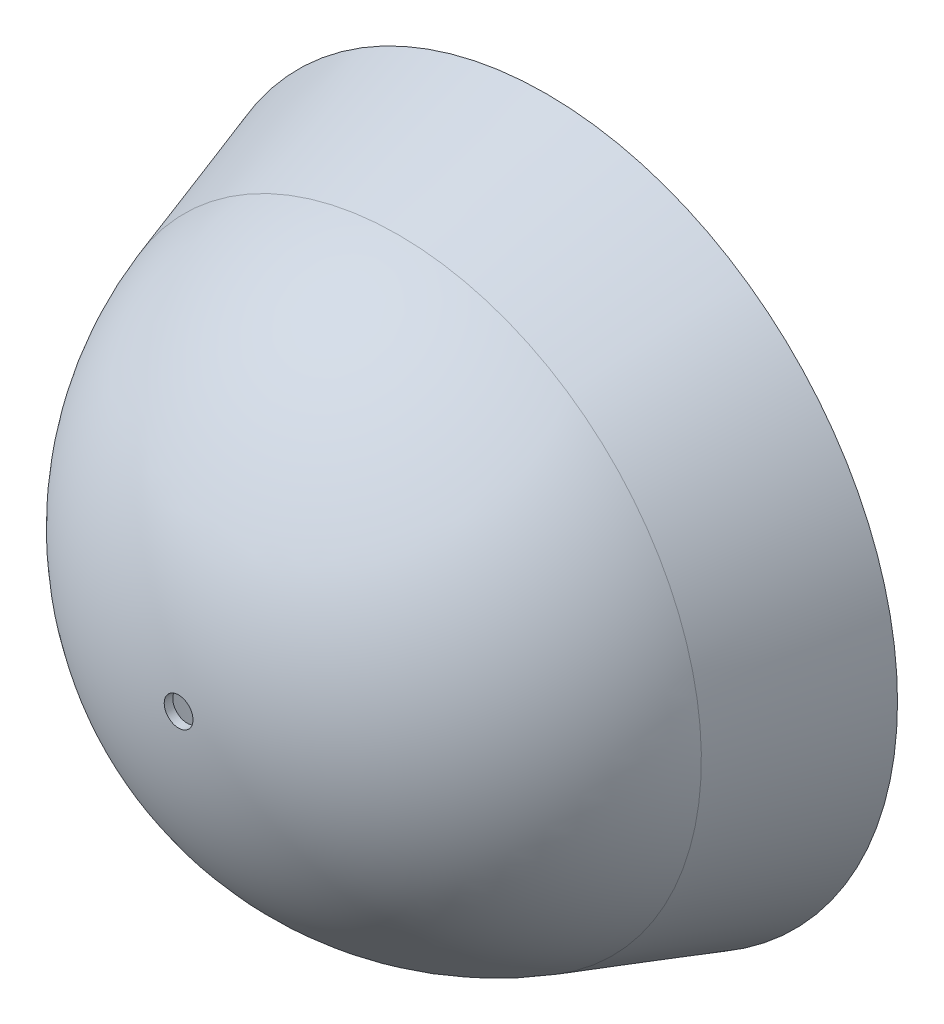
from build123d import *

# Parameters (mm, degrees)
SKETCH3_R                  = 3.683
CE_00_HOLE_AT_CENTER_DEPTH = 12.7


with BuildPart() as part:
    # Sketch1 → Revolve-Thin1 (revolve)
    with BuildSketch(Plane(origin=(0, 0, 0), x_dir=(0, 0, -1), z_dir=(1, 0, 0)), mode=Mode.PRIVATE) as revolve_thin1_sk:
        with BuildLine():
            ThreePointArc((-3.175, 0), (11.984276071, 46.655454401), (51.671776071, 75.490110981))
            Line((51.671776071, 75.490110981), (94.81101726, 89.506900124))
            ThreePointArc((94.81101726, 89.506900124), (97.98601726, 91.81367265), (99.198759346, 95.546109002))
            Line((99.198759346, 95.546109002), (99.198759346, 114.3))
            Line((99.198759346, 114.3), (97.014359346, 114.3))
            Line((97.014359346, 114.3), (97.014359346, 95.546109002))
            ThreePointArc((97.014359346, 95.546109002), (96.218800538, 93.097630755), (94.136000538, 91.584387978))
            Line((94.136000538, 91.584387978), (50.996759349, 77.567598835))
            ThreePointArc((50.996759349, 77.567598835), (10.217059349, 47.939412506), (-5.3594, 0))
            Line((-5.3594, 0), (-3.175, 0))
        make_face()
    revolve(revolve_thin1_sk.sketch.rotate(Axis((0, 0, -134.341700673), (0, 0, 1)), 90), axis=Axis((0, 0, -134.341700673), (0, 0, 1)))

    # Sketch5 → Cut-Revolve1 (revolve, cut)
    with BuildSketch(Plane(origin=(0, 0, 0), x_dir=(0, 0, -1), z_dir=(1, 0, 0))):
        with BuildLine():
            Line((-8.255, 0), (-23.88640598, 0))
            Line((-23.88640598, 0), (-23.88640598, 127.217845703))
            Line((-23.88640598, 127.217845703), (116.252745686, 127.217845703))
            Line((116.252745686, 127.217845703), (116.252745686, 73.62445992))
            Line((116.252745686, 73.62445992), (88.9, 73.62445992))
            Line((88.9, 73.62445992), (88.9, 92.92772229))
            Line((88.9, 92.92772229), (50.10196974, 80.321478084))
            ThreePointArc((50.10196974, 80.321478084), (7.87446974, 49.641403482), (-8.255, 0))
        make_face()
    revolve(axis=Axis((0, 0, -134.341700673), (0, 0, 1)), mode=Mode.SUBTRACT)

    # Sketch3 → CE-00 Hole at center (cut, symmetric)
    with BuildSketch(Plane.XY):
        with Locations(Location((0, 0, 0), (0, 0, 90))):
            Circle(SKETCH3_R)
    extrude(amount=CE_00_HOLE_AT_CENTER_DEPTH, both=True, mode=Mode.SUBTRACT)


solid = part.part
